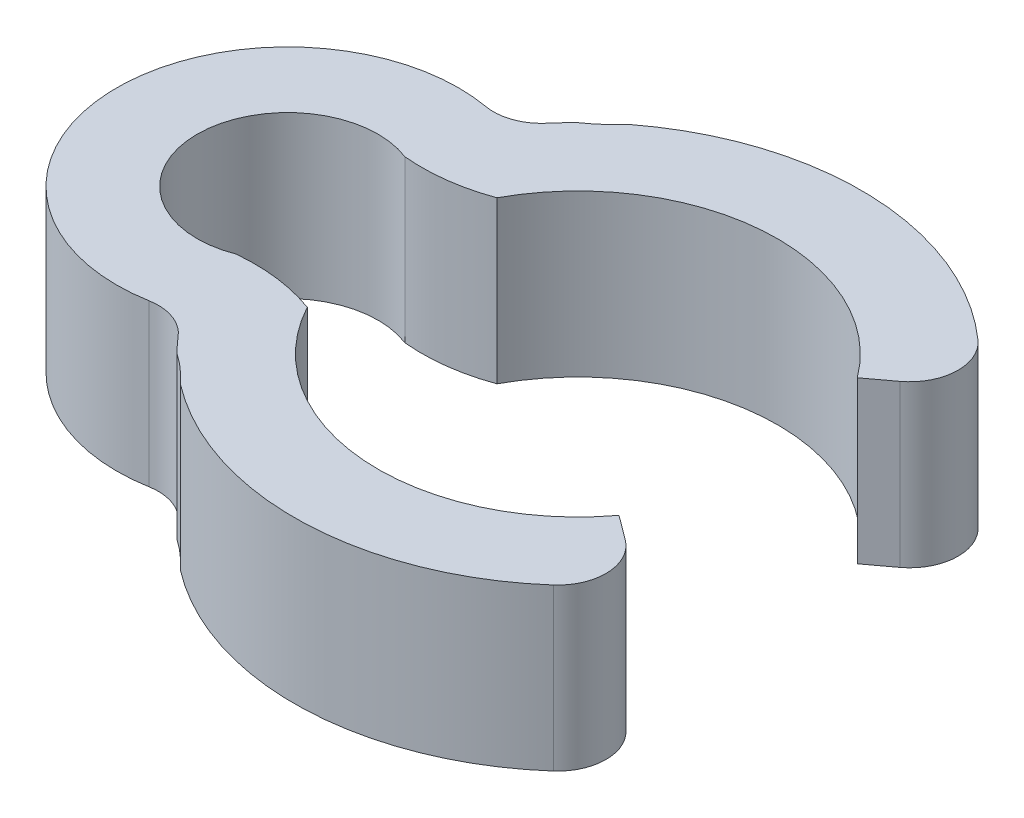
from build123d import *

# Parameters (mm, degrees)
BOSS_EXTRUDE3_DEPTH = 10
FILLET3_R           = 3


with BuildPart() as part:
    # Sketch1 → Boss-Extrude3 (new body)
    with BuildSketch(Plane(origin=(0, 0, 0), x_dir=(1, 0, 0), z_dir=(0, 1, 0))):
        with BuildLine():
            Line((-56.127249733, 13.064532605), (-51.956028901, 16.165106996))
            ThreePointArc((-51.956028901, 16.165106996), (-63.652726326, 23.094481669), (-76.795589263, 19.616821846))
            ThreePointArc((-76.795589263, 19.616821846), (-77.629630472, 18.791218581), (-78.553962744, 18.068131215))
            ThreePointArc((-78.553962744, 18.068131215), (-79.603636657, 16.913208133), (-80.546816269, 15.669795544))
            ThreePointArc((-80.546816269, 15.669795544), (-94.691323687, 5.670927287), (-80.546816269, -4.32794097))
            ThreePointArc((-80.546816269, -4.32794097), (-79.603636657, -5.571353559), (-78.553962744, -6.726276641))
            ThreePointArc((-78.553962744, -6.726276641), (-77.629630472, -7.449364007), (-76.795589263, -8.274967272))
            ThreePointArc((-76.795589263, -8.274967272), (-63.652726326, -11.752627095), (-51.956028901, -4.823252422))
            Line((-51.956028901, -4.823252422), (-56.127249733, -1.722678031))
            ThreePointArc((-56.127249733, -1.722678031), (-66.96819929, -6.690371176), (-76.981216312, -0.213979234))
            ThreePointArc((-76.981216312, -0.213979234), (-79.478589631, 0.394605678), (-82.048720515, 0.435548601))
            ThreePointArc((-82.048720515, 0.435548601), (-89.702342556, 5.670927287), (-82.048720515, 10.906305973))
            ThreePointArc((-82.048720515, 10.906305973), (-79.478589631, 10.947248896), (-76.981216312, 11.555833808))
            ThreePointArc((-76.981216312, 11.555833808), (-66.96819929, 18.03222575), (-56.127249733, 13.064532605))
        make_face()
    extrude(amount=BOSS_EXTRUDE3_DEPTH)

    # Fillet3
    fillet3_edges = [part.edges().sort_by_distance(p)[0] for p in [
        (-51.956028901, 5, 4.823252422),
        (-80.546816269, 5, 4.32794097),
        (-80.546816269, 5, -15.669795544),
        (-51.956028901, 5, -16.165106996),
    ]]
    fillet(fillet3_edges, radius=FILLET3_R)


solid = part.part
